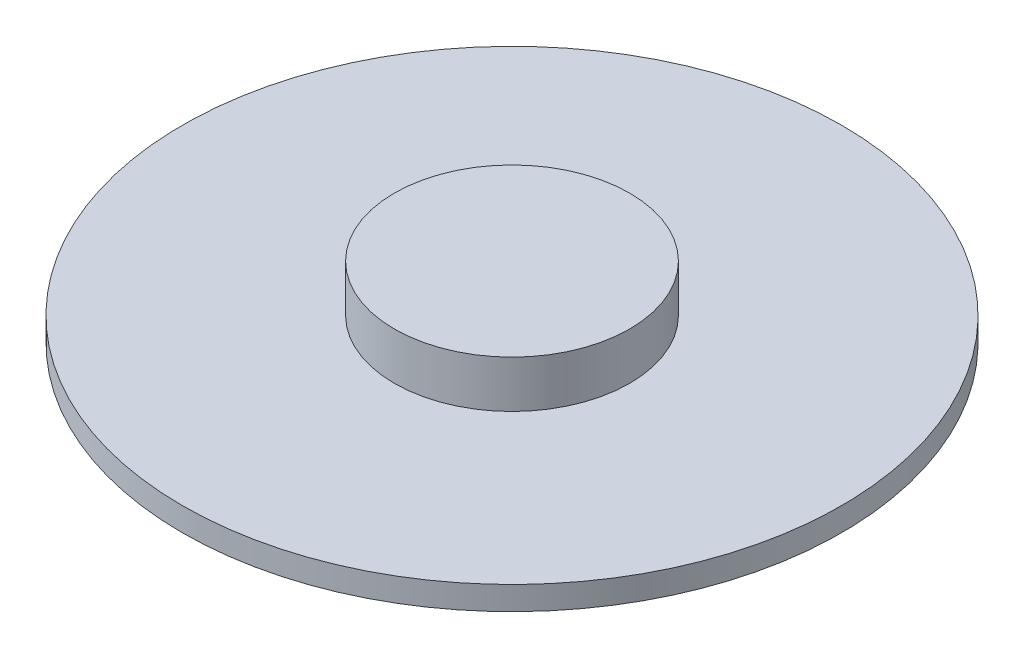
from build123d import *

# Parameters (mm, degrees)
CROQUIS1_R              = 70
SALIENTE_EXTRUIR1_DEPTH = 5
CROQUIS8_R              = 25
SALIENTE_EXTRUIR2_DEPTH = 10


with BuildPart() as part:
    # Croquis1 → Saliente-Extruir1 (new body)
    with BuildSketch(Plane(origin=(0, 0, 0), x_dir=(1, 0, 0), z_dir=(0, 1, 0))):
        with Locations(Location((0, 0, 0), (0, 0, 270))):
            Circle(CROQUIS1_R)
    extrude(amount=SALIENTE_EXTRUIR1_DEPTH)

    # Croquis8 → Saliente-Extruir2 (add)
    with BuildSketch(Plane(origin=(0, 5, 0), x_dir=(1, 0, 0), z_dir=(0, 1, 0))):
        with Locations(Location((0, 0, 0), (0, 0, 270))):
            Circle(CROQUIS8_R)
    extrude(amount=SALIENTE_EXTRUIR2_DEPTH)


solid = part.part
